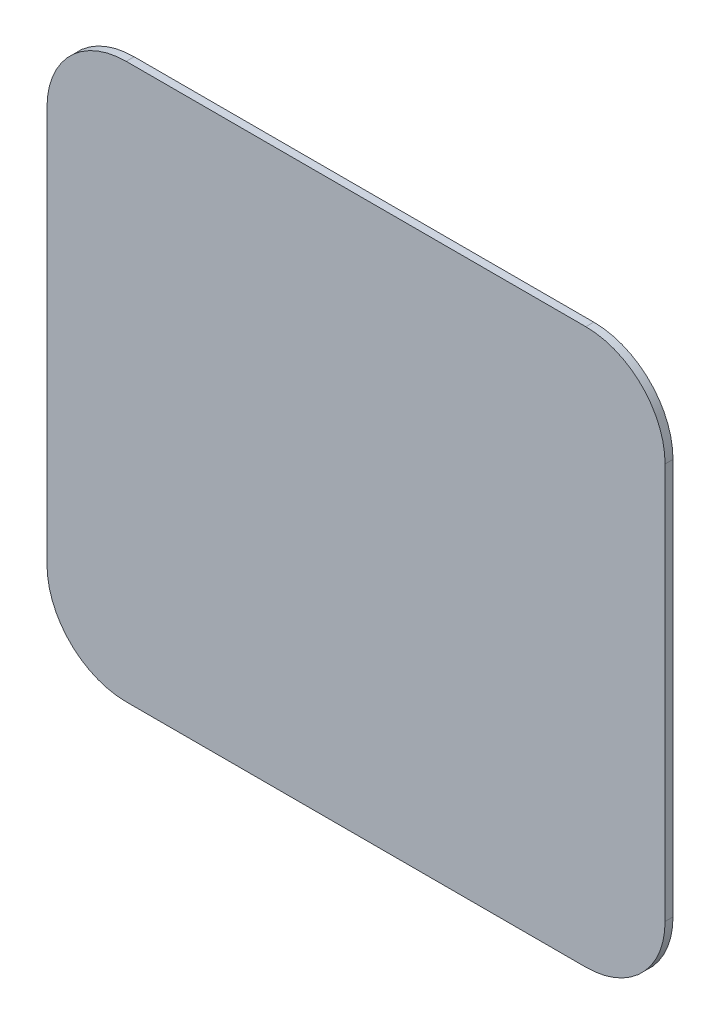
from build123d import *

# Parameters (mm, degrees)
SKETCH1_W           = 78
SKETCH1_H           = 70
BOSS_EXTRUDE1_DEPTH = 1
FILLET1_R           = 10
SKETCH2_R           = 5
BOSS_EXTRUDE3_DEPTH = 1


with BuildPart() as part:
    # Sketch1 → Boss-Extrude1 (new body)
    with BuildSketch(Plane.XY):
        with Locations((-0.075399098, 4.950190099)):
            Rectangle(SKETCH1_W, SKETCH1_H)
    extrude(amount=BOSS_EXTRUDE1_DEPTH)

    # Fillet1
    fillet1_edges = [part.edges().sort_by_distance(p)[0] for p in [
        (38.924600902, -30.049809901, 0.5),
        (-39.075399098, -30.049809901, 0.5),
        (-39.075399098, 39.950190099, 0.5),
        (38.924600902, 39.950190099, 0.5),
    ]]
    fillet(fillet1_edges, radius=FILLET1_R)

    # Sketch2 → Boss-Extrude3 (add)
    with BuildSketch(Plane(origin=(0, 0, 0), x_dir=(-1, 0, 0), z_dir=(0, 0, -1))):
        with BuildLine():
            Line((12.449767768, -7.424178572), (8.914233862, -3.888644666))
            ThreePointArc((8.914233862, -3.888644666), (12.575399098, 4.950190099), (8.914233862, 13.789024864))
            Line((8.914233862, 13.789024864), (12.449767768, 17.32455877))
            ThreePointArc((12.449767768, 17.32455877), (17.575399098, 4.950190099), (12.449767768, -7.424178572))
        make_face()
        with Locations(Location((0.075399098, 4.950190099, 0), (0, 0, 180))):
            Circle(SKETCH2_R)
        with BuildLine():
            Line((21.288602533, -16.263013337), (17.753068627, -12.727479431))
            ThreePointArc((17.753068627, -12.727479431), (25.075399098, 4.950190099), (17.753068627, 22.627859629))
            Line((17.753068627, 22.627859629), (21.288602533, 26.163393535))
            ThreePointArc((21.288602533, 26.163393535), (30.075399098, 4.950190099), (21.288602533, -16.263013337))
        make_face()
        with BuildLine():
            Line((-12.298969573, -7.424178572), (-8.763435667, -3.888644666))
            ThreePointArc((-8.763435667, -3.888644666), (-12.424600902, 4.950190099), (-8.763435667, 13.789024864))
            Line((-8.763435667, 13.789024864), (-12.298969573, 17.32455877))
            ThreePointArc((-12.298969573, 17.32455877), (-17.424600902, 4.950190099), (-12.298969573, -7.424178572))
        make_face()
        with BuildLine():
            Line((-21.137804338, -16.263013337), (-17.602270432, -12.727479431))
            ThreePointArc((-17.602270432, -12.727479431), (-24.924600902, 4.950190099), (-17.602270432, 22.627859629))
            Line((-17.602270432, 22.627859629), (-21.137804338, 26.163393535))
            ThreePointArc((-21.137804338, 26.163393535), (-29.924600902, 4.950190099), (-21.137804338, -16.263013337))
        make_face()
    extrude(amount=BOSS_EXTRUDE3_DEPTH)


solid = part.part
